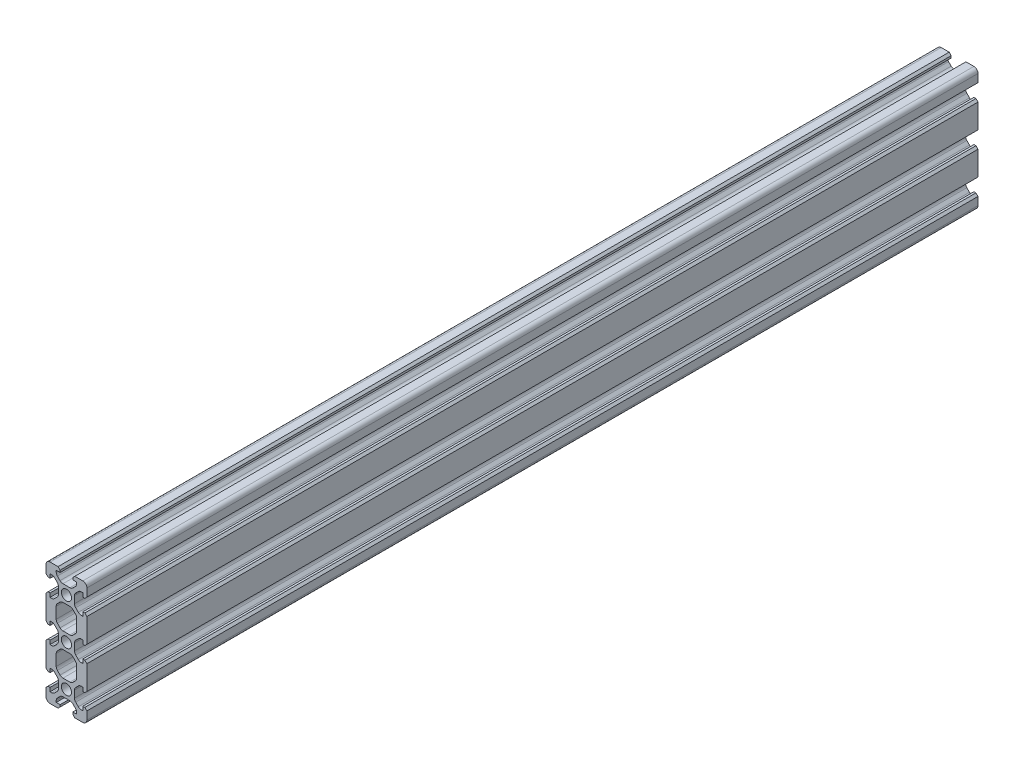
from build123d import *

# Parameters (mm, degrees)
SKETCH1_R           = 2.5
BOSS_EXTRUDE1_DEPTH = 436


with BuildPart() as part:
    # Sketch1 → Boss-Extrude1 (new body)
    with BuildSketch(Plane.XY):
        with BuildLine():
            Line((3.1, 29), (4.1, 30))
            Line((4.1, 30), (8, 30))
            ThreePointArc((8, 30), (9.414213562, 29.414213562), (10, 28))
            Line((10, 28), (10, 24.1))
            Line((10, 24.1), (9, 23.1))
            Line((9, 23.1), (8, 23.1))
            Line((8, 23.1), (8, 25))
            Line((8, 25), (7.242640687, 25))
            ThreePointArc((7.242640687, 25), (6.477273822, 24.847759065), (5.828427125, 24.414213562))
            Line((5.828427125, 24.414213562), (4.537854624, 23.123641061))
            ThreePointArc((4.537854624, 23.123641061), (4.104309121, 22.474794364), (3.952068186, 21.709427499))
            Line((3.952068186, 21.709427499), (3.952068186, 18.290572501))
            ThreePointArc((3.952068186, 18.290572501), (4.104309121, 17.525205636), (4.537854624, 16.876358939))
            Line((4.537854624, 16.876358939), (5.828427125, 15.585786438))
            ThreePointArc((5.828427125, 15.585786438), (6.477273822, 15.152240935), (7.242640687, 15))
            Line((7.242640687, 15), (8, 15))
            Line((8, 15), (8, 16.9))
            Line((8, 16.9), (9, 16.9))
            Line((9, 16.9), (10, 15.9))
            Line((10, 15.9), (10, 4.1))
            Line((10, 4.1), (9, 3.1))
            Line((9, 3.1), (8, 3.1))
            Line((8, 3.1), (8, 5))
            Line((8, 5), (7.242640687, 5))
            ThreePointArc((7.242640687, 5), (6.477273822, 4.847759065), (5.828427125, 4.414213562))
            Line((5.828427125, 4.414213562), (4.537854624, 3.123641061))
            ThreePointArc((4.537854624, 3.123641061), (4.104309121, 2.474794364), (3.952068186, 1.709427499))
            Line((3.952068186, 1.709427499), (3.952068186, -1.709427499))
            ThreePointArc((3.952068186, -1.709427499), (4.104309121, -2.474794364), (4.537854624, -3.123641061))
            Line((4.537854624, -3.123641061), (5.828427125, -4.414213562))
            ThreePointArc((5.828427125, -4.414213562), (6.477273822, -4.847759065), (7.242640687, -5))
            Line((7.242640687, -5), (8, -5))
            Line((8, -5), (8, -3.1))
            Line((8, -3.1), (9, -3.1))
            Line((9, -3.1), (10, -4.1))
            Line((10, -4.1), (10, -15.9))
            Line((10, -15.9), (9, -16.9))
            Line((9, -16.9), (8, -16.9))
            Line((8, -16.9), (8, -15))
            Line((8, -15), (7.242640687, -15))
            ThreePointArc((7.242640687, -15), (6.477273822, -15.152240935), (5.828427125, -15.585786438))
            Line((5.828427125, -15.585786438), (4.537854624, -16.876358939))
            ThreePointArc((4.537854624, -16.876358939), (4.104309121, -17.525205636), (3.952068186, -18.290572501))
            Line((3.952068186, -18.290572501), (3.952068186, -21.709427499))
            ThreePointArc((3.952068186, -21.709427499), (4.104309121, -22.474794364), (4.537854624, -23.123641061))
            Line((4.537854624, -23.123641061), (5.828427125, -24.414213562))
            ThreePointArc((5.828427125, -24.414213562), (6.477273822, -24.847759065), (7.242640687, -25))
            Line((7.242640687, -25), (8, -25))
            Line((8, -25), (8, -23.1))
            Line((8, -23.1), (9, -23.1))
            Line((9, -23.1), (10, -24.1))
            Line((10, -24.1), (10, -28))
            ThreePointArc((10, -28), (9.414213562, -29.414213562), (8, -30))
            Line((8, -30), (4.1, -30))
            Line((4.1, -30), (3.1, -29))
            Line((3.1, -29), (3.1, -28))
            Line((3.1, -28), (5, -28))
            Line((5, -28), (5, -27.242640687))
            ThreePointArc((5, -27.242640687), (4.847759065, -26.477273822), (4.414213562, -25.828427125))
            Line((4.414213562, -25.828427125), (3.123641061, -24.537854624))
            ThreePointArc((3.123641061, -24.537854624), (2.474794364, -24.104309121), (1.709427499, -23.952068186))
            Line((1.709427499, -23.952068186), (-1.709427499, -23.952068186))
            ThreePointArc((-1.709427499, -23.952068186), (-2.474794364, -24.104309121), (-3.123641061, -24.537854624))
            Line((-3.123641061, -24.537854624), (-4.414213562, -25.828427125))
            ThreePointArc((-4.414213562, -25.828427125), (-4.847759065, -26.477273822), (-5, -27.242640687))
            Line((-5, -27.242640687), (-5, -28))
            Line((-5, -28), (-3.1, -28))
            Line((-3.1, -28), (-3.1, -29))
            Line((-3.1, -29), (-4.1, -30))
            Line((-4.1, -30), (-8, -30))
            ThreePointArc((-8, -30), (-9.414213562, -29.414213562), (-10, -28))
            Line((-10, -28), (-10, -24.1))
            Line((-10, -24.1), (-9, -23.1))
            Line((-9, -23.1), (-8, -23.1))
            Line((-8, -23.1), (-8, -25))
            Line((-8, -25), (-7.242640687, -25))
            ThreePointArc((-7.242640687, -25), (-6.477273822, -24.847759065), (-5.828427125, -24.414213562))
            Line((-5.828427125, -24.414213562), (-4.537854624, -23.123641061))
            ThreePointArc((-4.537854624, -23.123641061), (-4.104309121, -22.474794364), (-3.952068186, -21.709427499))
            Line((-3.952068186, -21.709427499), (-3.952068186, -18.290572501))
            ThreePointArc((-3.952068186, -18.290572501), (-4.104309121, -17.525205636), (-4.537854624, -16.876358939))
            Line((-4.537854624, -16.876358939), (-5.828427125, -15.585786438))
            ThreePointArc((-5.828427125, -15.585786438), (-6.477273822, -15.152240935), (-7.242640687, -15))
            Line((-7.242640687, -15), (-8, -15))
            Line((-8, -15), (-8, -16.9))
            Line((-8, -16.9), (-9, -16.9))
            Line((-9, -16.9), (-10, -15.9))
            Line((-10, -15.9), (-10, -4.1))
            Line((-10, -4.1), (-9, -3.1))
            Line((-9, -3.1), (-8, -3.1))
            Line((-8, -3.1), (-8, -5))
            Line((-8, -5), (-7.242640687, -5))
            ThreePointArc((-7.242640687, -5), (-6.477273822, -4.847759065), (-5.828427125, -4.414213562))
            Line((-5.828427125, -4.414213562), (-4.537854624, -3.123641061))
            ThreePointArc((-4.537854624, -3.123641061), (-4.104309121, -2.474794364), (-3.952068186, -1.709427499))
            Line((-3.952068186, -1.709427499), (-3.952068186, 1.709427499))
            ThreePointArc((-3.952068186, 1.709427499), (-4.104309121, 2.474794364), (-4.537854624, 3.123641061))
            Line((-4.537854624, 3.123641061), (-5.828427125, 4.414213562))
            ThreePointArc((-5.828427125, 4.414213562), (-6.477273822, 4.847759065), (-7.242640687, 5))
            Line((-7.242640687, 5), (-8, 5))
            Line((-8, 5), (-8, 3.1))
            Line((-8, 3.1), (-9, 3.1))
            Line((-9, 3.1), (-10, 4.1))
            Line((-10, 4.1), (-10, 15.9))
            Line((-10, 15.9), (-9, 16.9))
            Line((-9, 16.9), (-8, 16.9))
            Line((-8, 16.9), (-8, 15))
            Line((-8, 15), (-7.242640687, 15))
            ThreePointArc((-7.242640687, 15), (-6.477273822, 15.152240935), (-5.828427125, 15.585786438))
            Line((-5.828427125, 15.585786438), (-4.537854624, 16.876358939))
            ThreePointArc((-4.537854624, 16.876358939), (-4.104309121, 17.525205636), (-3.952068186, 18.290572501))
            Line((-3.952068186, 18.290572501), (-3.952068186, 21.709427499))
            ThreePointArc((-3.952068186, 21.709427499), (-4.104309121, 22.474794364), (-4.537854624, 23.123641061))
            Line((-4.537854624, 23.123641061), (-5.828427125, 24.414213562))
            ThreePointArc((-5.828427125, 24.414213562), (-6.477273822, 24.847759065), (-7.242640687, 25))
            Line((-7.242640687, 25), (-8, 25))
            Line((-8, 25), (-8, 23.1))
            Line((-8, 23.1), (-9, 23.1))
            Line((-9, 23.1), (-10, 24.1))
            Line((-10, 24.1), (-10, 28))
            ThreePointArc((-10, 28), (-9.414213562, 29.414213562), (-8, 30))
            Line((-8, 30), (-4.1, 30))
            Line((-4.1, 30), (-3.1, 29))
            Line((-3.1, 29), (-3.1, 28))
            Line((-3.1, 28), (-5, 28))
            Line((-5, 28), (-5, 27.242640687))
            ThreePointArc((-5, 27.242640687), (-4.847759065, 26.477273822), (-4.414213562, 25.828427125))
            Line((-4.414213562, 25.828427125), (-3.123641061, 24.537854624))
            ThreePointArc((-3.123641061, 24.537854624), (-2.474794364, 24.104309121), (-1.709427499, 23.952068186))
            Line((-1.709427499, 23.952068186), (1.709427499, 23.952068186))
            ThreePointArc((1.709427499, 23.952068186), (2.474794364, 24.104309121), (3.123641061, 24.537854624))
            Line((3.123641061, 24.537854624), (4.414213562, 25.828427125))
            ThreePointArc((4.414213562, 25.828427125), (4.847759065, 26.477273822), (5, 27.242640687))
            Line((5, 27.242640687), (5, 28))
            Line((5, 28), (3.1, 28))
            Line((3.1, 28), (3.1, 29))
        make_face()
        with Locations((0, -20)):
            Circle(SKETCH1_R, mode=Mode.SUBTRACT)
        Circle(SKETCH1_R, mode=Mode.SUBTRACT)
        with Locations((0, 20)):
            Circle(SKETCH1_R, mode=Mode.SUBTRACT)
        with BuildLine():
            Line((4.414213562, -14.171572875), (3.123641061, -15.462145376))
            ThreePointArc((3.123641061, -15.462145376), (2.474794364, -15.895690879), (1.709427499, -16.047931814))
            Line((1.709427499, -16.047931814), (-1.709427499, -16.047931814))
            ThreePointArc((-1.709427499, -16.047931814), (-2.474794364, -15.895690879), (-3.123641061, -15.462145376))
            Line((-3.123641061, -15.462145376), (-4.414213562, -14.171572875))
            ThreePointArc((-4.414213562, -14.171572875), (-4.847759065, -13.522726178), (-5, -12.757359313))
            Line((-5, -12.757359313), (-5, -7.242640687))
            ThreePointArc((-5, -7.242640687), (-4.847759065, -6.477273822), (-4.414213562, -5.828427125))
            Line((-4.414213562, -5.828427125), (-3.123641061, -4.537854624))
            ThreePointArc((-3.123641061, -4.537854624), (-2.474794364, -4.104309121), (-1.709427499, -3.952068186))
            Line((-1.709427499, -3.952068186), (1.709427499, -3.952068186))
            ThreePointArc((1.709427499, -3.952068186), (2.474794364, -4.104309121), (3.123641061, -4.537854624))
            Line((3.123641061, -4.537854624), (4.414213562, -5.828427125))
            ThreePointArc((4.414213562, -5.828427125), (4.847759065, -6.477273822), (5, -7.242640687))
            Line((5, -7.242640687), (5, -12.757359313))
            ThreePointArc((5, -12.757359313), (4.847759065, -13.522726178), (4.414213562, -14.171572875))
        make_face(mode=Mode.SUBTRACT)
        with BuildLine():
            Line((5, 7.242640687), (5, 12.757359313))
            ThreePointArc((5, 12.757359313), (4.847759065, 13.522726178), (4.414213562, 14.171572875))
            Line((4.414213562, 14.171572875), (3.123641061, 15.462145376))
            ThreePointArc((3.123641061, 15.462145376), (2.474794364, 15.895690879), (1.709427499, 16.047931814))
            Line((1.709427499, 16.047931814), (-1.709427499, 16.047931814))
            ThreePointArc((-1.709427499, 16.047931814), (-2.474794364, 15.895690879), (-3.123641061, 15.462145376))
            Line((-3.123641061, 15.462145376), (-4.414213562, 14.171572875))
            ThreePointArc((-4.414213562, 14.171572875), (-4.847759065, 13.522726178), (-5, 12.757359313))
            Line((-5, 12.757359313), (-5, 7.242640687))
            ThreePointArc((-5, 7.242640687), (-4.847759065, 6.477273822), (-4.414213562, 5.828427125))
            Line((-4.414213562, 5.828427125), (-3.123641061, 4.537854624))
            ThreePointArc((-3.123641061, 4.537854624), (-2.474794364, 4.104309121), (-1.709427499, 3.952068186))
            Line((-1.709427499, 3.952068186), (1.709427499, 3.952068186))
            ThreePointArc((1.709427499, 3.952068186), (2.474794364, 4.104309121), (3.123641061, 4.537854624))
            Line((3.123641061, 4.537854624), (4.414213562, 5.828427125))
            ThreePointArc((4.414213562, 5.828427125), (4.847759065, 6.477273822), (5, 7.242640687))
        make_face(mode=Mode.SUBTRACT)
    extrude(amount=BOSS_EXTRUDE1_DEPTH)


solid = part.part
